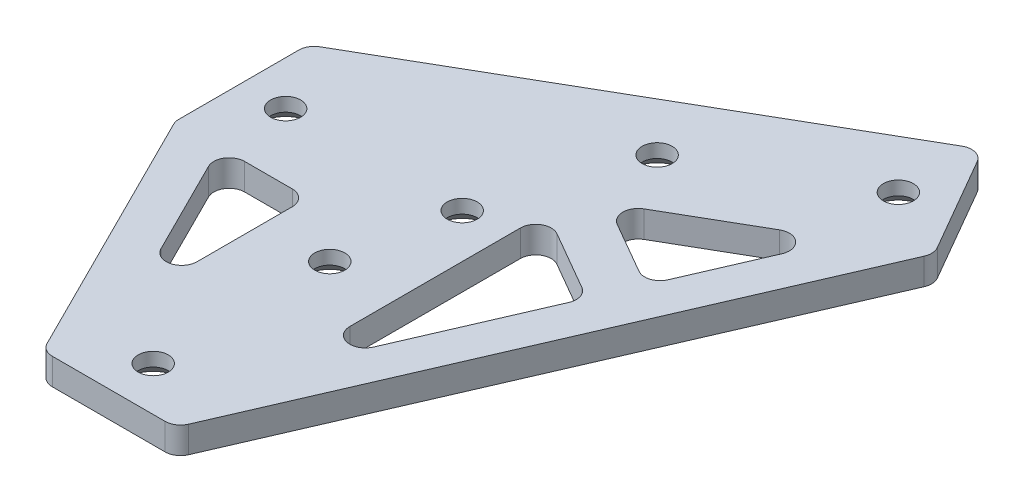
from build123d import *

# Parameters (mm, degrees)
SKETCH_4_R                   = 1.6
EXTRUDE_1_DEPTH              = 1.5
CUT_EXTRUDE_2_DEPTH          = 3
FILLET_2_R                   = 1.75
HOLE_WIZARD_M3_1_D           = 3.4
HOLE_WIZARD_M3_1_DEPTH       = 5.978536948
HOLE_WIZARD_M3_1_CSINK_D     = 6.3
HOLE_WIZARD_M3_1_CSINK_ANGLE = 90
HOLE_WIZARD_M3_1_TIP         = 1.021463052


with BuildPart() as part:
    # ｽｹｯﾁ4 → ﾎﾞｽ - 押し出し1 (new, symmetric)
    with BuildSketch(Plane(origin=(0, 0, 0), x_dir=(1, 0, 0), z_dir=(0, 1, 0))):
        Polygon((-30, 0), (-30, 15), (18.480762114, 42.990381057), (25.980762114, 30), (0, -30), (-15, -30), align=None)
        with Locations(Location((0.580127019, 23.995190528, 0), (0, 0, 270))):
            Circle(SKETCH_4_R, mode=Mode.SUBTRACT)
        with Locations(Location((-5, 7.5, 0), (0, 0, 270))):
            Circle(SKETCH_4_R, mode=Mode.SUBTRACT)
        with Locations(Location((-7.5, -5, 0), (0, 0, 270))):
            Circle(SKETCH_4_R, mode=Mode.SUBTRACT)
        with Locations(Location((-7.5, -25, 0), (0, 0, 270))):
            Circle(SKETCH_4_R, mode=Mode.SUBTRACT)
        with Locations(Location((-25, 7.5, 0), (0, 0, 270))):
            Circle(SKETCH_4_R, mode=Mode.SUBTRACT)
        with Locations(Location((17.900635095, 33.995190528, 0), (0, 0, 270))):
            Circle(SKETCH_4_R, mode=Mode.SUBTRACT)
    extrude(amount=EXTRUDE_1_DEPTH, both=True)

    # ｽｹｯﾁ5 → ｶｯﾄ - 押し出し2 (cut)
    with BuildSketch(Plane(origin=(0, 1.5, 0), x_dir=(1, 0, 0), z_dir=(0, 1, 0))):
        Polygon((12.665448219, 10.574351407), (19.442413698, 26.225082782), (6.92820323, 19), (4.714101615, 15.165063509), align=None)
        Polygon((4.714101615, 15.165063509), (6.92820323, 19), (2.5, 16.443375673), align=None)
        Polygon((2.214101615, 10.834936491), (0, 12.113248654), (0, 7), align=None)
        Polygon((0, 0), (0, -18.675248347), (10.665448219, 5.955549254), (2.214101615, 10.834936491), (0, 7), align=None)
        Polygon((-15, 0), (-24.968847051, 0), (-15, -19.937694101), align=None)
    extrude(amount=-CUT_EXTRUDE_2_DEPTH, mode=Mode.SUBTRACT)

    # ﾌｨﾚｯﾄ2
    fillet_2_edges = [part.edges().sort_by_distance(p)[0] for p in [
        (-30, 0, 0),
        (-30, 0, -15),
        (18.480762114, 0, -42.990381057),
        (25.980762114, 0, -30),
        (0, 0, 30),
        (-15, 0, 30),
        (-24.968847051, 0, 0),
        (-15, 0, 0),
        (-15, 0, 19.937694101),
        (0, 0, 18.675248347),
        (0, 0, -12.113248654),
        (10.665448219, 0, -5.955549254),
        (2.5, 0, -16.443375673),
        (19.442413698, 0, -26.225082782),
        (12.665448219, 0, -10.574351407),
    ]]
    fillet(fillet_2_edges, radius=FILLET_2_R)

    # M3 丸皿ねじ用皿穴1
    with Locations(Plane(origin=(-7.5, -1.5, 25), x_dir=(0, 0, -1), z_dir=(0, -1, 0))):
        with Locations((0, 0), (20, 0), (32.5, -17.5), (32.5, 2.5), (48.995190528, 8.080127019), (58.995190528, 25.400635095)):
            CounterSinkHole(HOLE_WIZARD_M3_1_D / 2, HOLE_WIZARD_M3_1_CSINK_D / 2, depth=HOLE_WIZARD_M3_1_DEPTH, counter_sink_angle=HOLE_WIZARD_M3_1_CSINK_ANGLE)
            with Locations((0, 0, -(HOLE_WIZARD_M3_1_DEPTH + HOLE_WIZARD_M3_1_TIP / 2))):  # 118° drill point
                Cone(0, HOLE_WIZARD_M3_1_D / 2, HOLE_WIZARD_M3_1_TIP, mode=Mode.SUBTRACT)


solid = part.part
